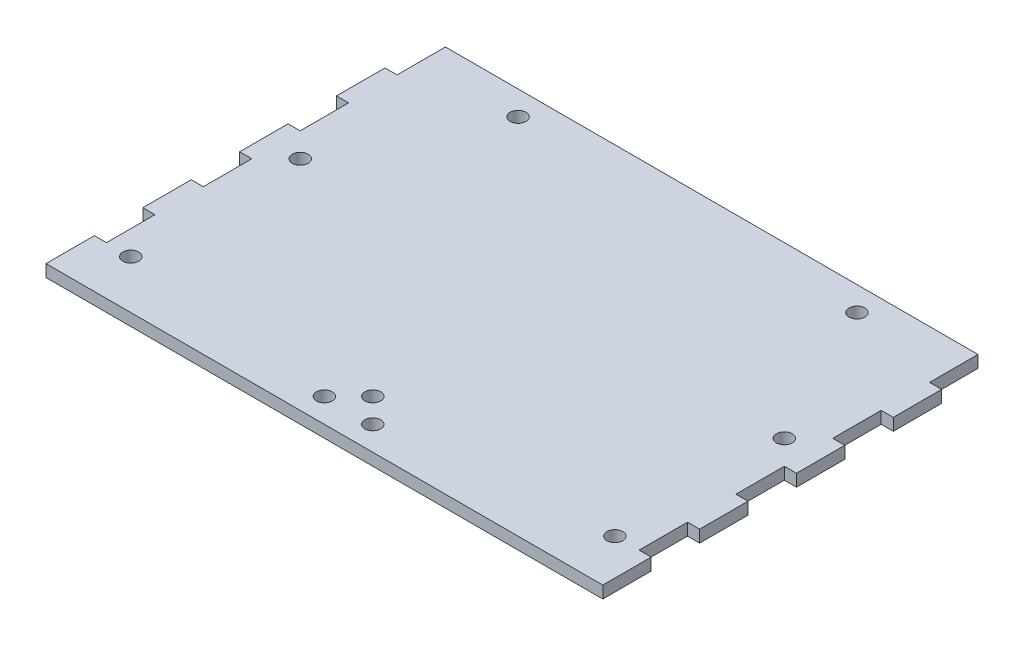
from build123d import *

# Parameters (mm, degrees)
SKETCH2_R           = 2.0828
BOSS_EXTRUDE1_DEPTH = 3.175


with BuildPart() as part:
    # Sketch2 → Boss-Extrude1 (new body)
    with BuildSketch(Plane(origin=(0, 0, 0), x_dir=(1, 0, 0), z_dir=(0, 1, 0))):
        Polygon((3.175, 13.229166667), (3.175, 25.929166667), (0, 25.929166667), (0, 38.629166667), (3.175, 38.629166667), (3.175, 51.329166667), (0, 51.329166667), (0, 64.029166667), (3.175, 64.029166667), (3.175, 76.729166667), (0, 76.729166667), (0, 89.429166667), (3.175, 89.429166667), (3.175, 102.129166667), (142.875, 102.129166667), (142.875, 89.429166667), (146.05, 89.429166667), (146.05, 76.729166667), (142.875, 76.729166667), (142.875, 64.029166667), (146.05, 64.029166667), (146.05, 51.329166667), (142.875, 51.329166667), (142.875, 38.629166667), (146.05, 38.629166667), (146.05, 25.929166667), (142.875, 25.929166667), (142.875, 13.229166667), (146.05, 13.229166667), (146.05, 0.529166667), (0, 0.529166667), (0, 13.229166667), align=None)
        with Locations(Location((136.525, 57.679166667, 0), (0, 0, 90))):
            Circle(SKETCH2_R, mode=Mode.SUBTRACT)
        with Locations(Location((9.525, 13.229166667, 0), (0, 0, 270))):
            Circle(SKETCH2_R, mode=Mode.SUBTRACT)
        with Locations(Location((9.525, 57.679166667, 0), (0, 0, 270))):
            Circle(SKETCH2_R, mode=Mode.SUBTRACT)
        with Locations(Location((136.525, 13.229166667, 0), (0, 0, 90))):
            Circle(SKETCH2_R, mode=Mode.SUBTRACT)
        with Locations(Location((79.375, 6.879166667, 0), (0, 0, 270))):
            Circle(SKETCH2_R, mode=Mode.SUBTRACT)
        with Locations(Location((73.025, 13.229166667, 0), (0, 0, 270))):
            Circle(SKETCH2_R, mode=Mode.SUBTRACT)
        with Locations(Location((66.675, 6.879166667, 0), (0, 0, 270))):
            Circle(SKETCH2_R, mode=Mode.SUBTRACT)
        with Locations(Location((117.475, 95.779166667, 0), (0, 0, 270))):
            Circle(SKETCH2_R, mode=Mode.SUBTRACT)
        with Locations(Location((28.575, 95.779166667, 0), (0, 0, 90))):
            Circle(SKETCH2_R, mode=Mode.SUBTRACT)
    extrude(amount=BOSS_EXTRUDE1_DEPTH)


solid = part.part
